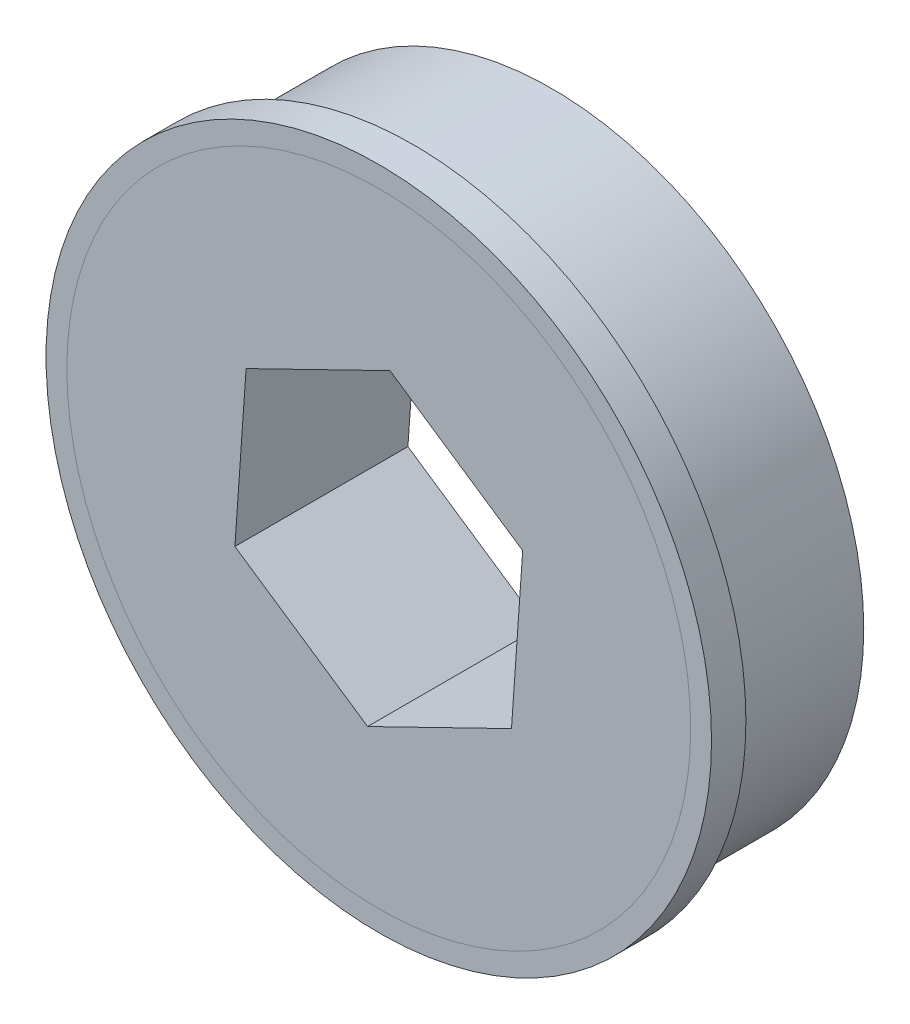
from build123d import *

# Parameters (mm, degrees)
SKETCH1_R           = 14.2875
BOSS_EXTRUDE1_DEPTH = 7.9248
CUT_EXTRUDE1_DEPTH  = 7.9248
SKETCH3_R           = 15.24
SKETCH3_R_2         = 14.2875
BOSS_EXTRUDE2_DEPTH = 1.5748


with BuildPart() as part:
    # Sketch1 → Boss-Extrude1 (new body)
    with BuildSketch(Plane.XY):
        Circle(SKETCH1_R)
    extrude(amount=BOSS_EXTRUDE1_DEPTH)

    # Sketch2 → Cut-Extrude1 (cut)
    with BuildSketch(Plane.XY.offset(7.9248)):
        Polygon((6.5908862, 3.213028545), (0.512878757, 7.314389155), (-6.078007443, 4.101360611), (-6.5908862, -3.213028545), (-0.512878757, -7.314389155), (6.078007443, -4.101360611), align=None)
    extrude(amount=-CUT_EXTRUDE1_DEPTH, mode=Mode.SUBTRACT)


with BuildPart() as body_2:
    # Sketch3 → Boss-Extrude2 (new body)
    with BuildSketch(Plane.XY.offset(7.9248)):
        Circle(SKETCH3_R)
        Circle(SKETCH3_R_2, mode=Mode.SUBTRACT)
    extrude(amount=-BOSS_EXTRUDE2_DEPTH)


solid = Compound([part.part, body_2.part])
